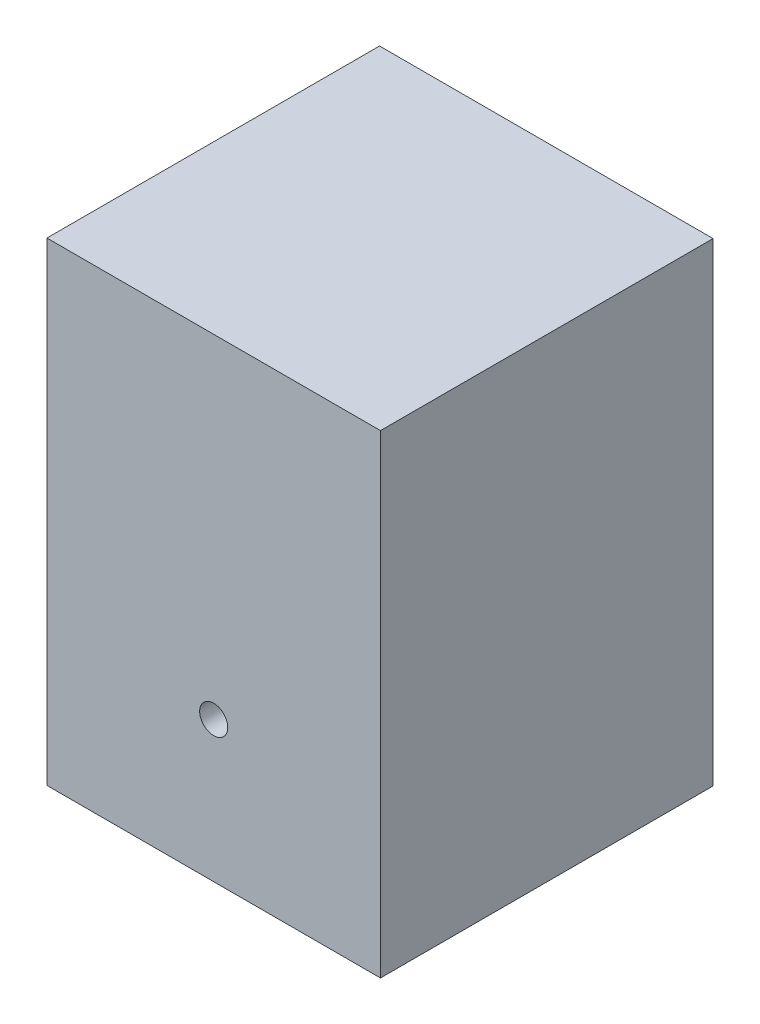
from build123d import *

# Parameters (mm, degrees)
SKETCH_1_W          = 35.6
SKETCH_1_H          = 50.6
EXTRUDE_1_DEPTH     = 35.5
SKETCH_2_R          = 1.5
CUT_EXTRUDE_1_DEPTH = 7


with BuildPart() as part:
    # 草图1 → 凸台-拉伸1 (new body)
    with BuildSketch(Plane.XY):
        with Locations((17.8, 25.3)):
            Rectangle(SKETCH_1_W, SKETCH_1_H)
    extrude(amount=EXTRUDE_1_DEPTH)

    # 草图2 → 切除-拉伸1 (cut)
    with BuildSketch(Plane.XY.offset(35.5)):
        with Locations((17.8, 15)):
            Circle(SKETCH_2_R)
    extrude(amount=-CUT_EXTRUDE_1_DEPTH, mode=Mode.SUBTRACT)


solid = part.part
